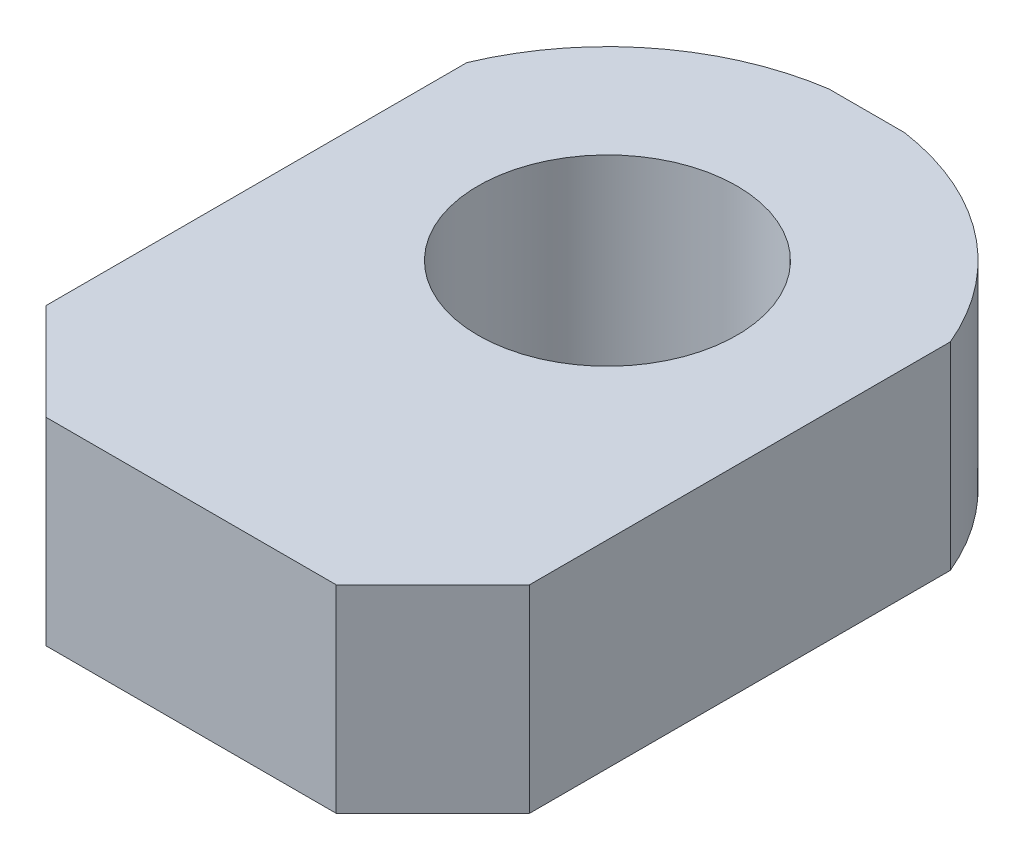
from build123d import *

# Parameters (mm, degrees)
SKETCH1_R           = 7.65
BOSS_EXTRUDE1_DEPTH = 11.7


with BuildPart() as part:
    # Sketch1 → Boss-Extrude1 (new body)
    with BuildSketch(Plane(origin=(0, 0, 0), x_dir=(1, 0, 0), z_dir=(0, 1, 0))):
        with BuildLine():
            Line((-14.29, 5.977959518), (-14.29, -18.894))
            Line((-14.29, -18.894), (-8.574, -24.61))
            Line((-8.574, -24.61), (8.574, -24.61))
            Line((8.574, -24.61), (14.29, -18.894))
            Line((14.29, -18.894), (14.29, 5.977959518))
            ThreePointArc((14.29, 5.977959518), (9.48764436, 12.244374402), (2.220630541, 15.33))
            Line((2.220630541, 15.33), (-2.220630541, 15.33))
            ThreePointArc((-2.220630541, 15.33), (-9.48764436, 12.244374402), (-14.29, 5.977959518))
        make_face()
        with Locations(Location((0, 0, 0), (0, 0, 270))):
            Circle(SKETCH1_R, mode=Mode.SUBTRACT)
    extrude(amount=BOSS_EXTRUDE1_DEPTH)


solid = part.part
